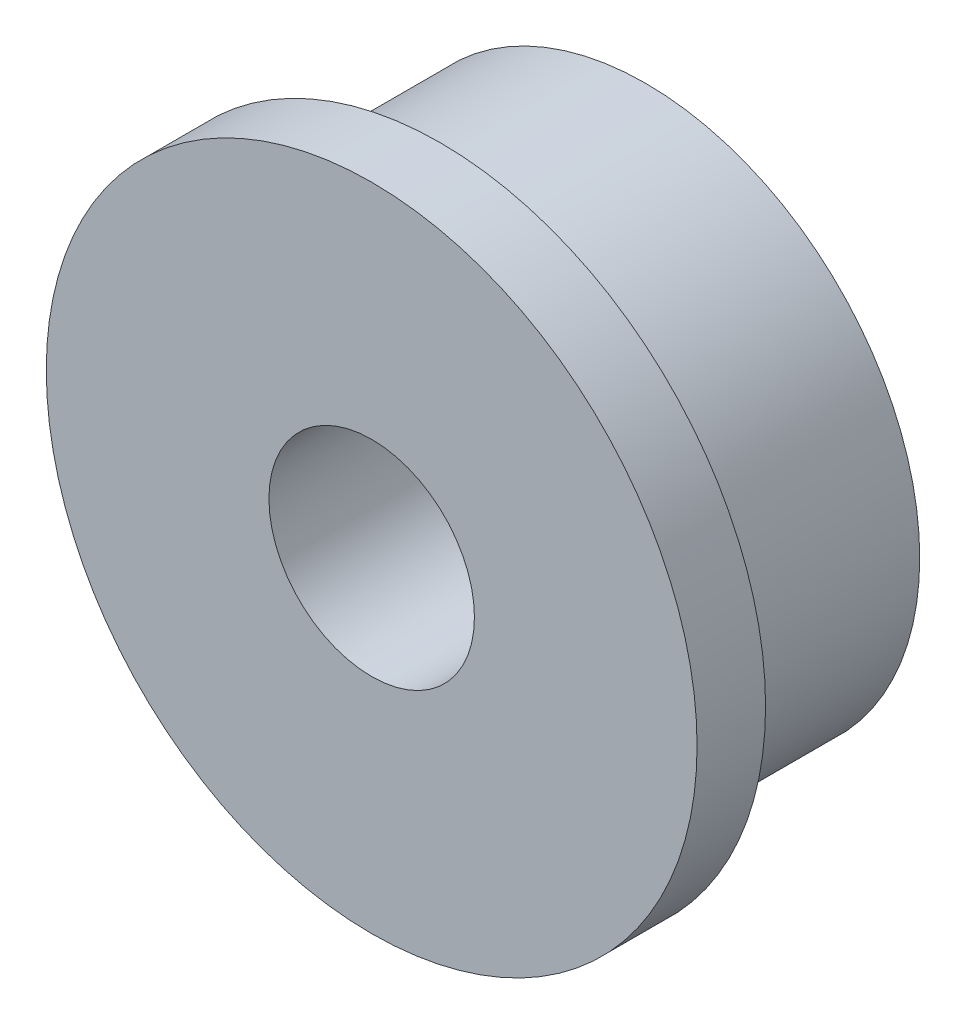
from build123d import *

# Parameters (mm, degrees)
SKETCH_1_R      = 4
SKETCH_1_R_2    = 1.5
EXTRUDE_1_DEPTH = 3
SKETCH_2_R      = 4.75
SKETCH_2_R_2    = 1.5
EXTRUDE_2_DEPTH = 1


with BuildPart() as part:
    # 草图1 → 凸台-拉伸1 (new body)
    with BuildSketch(Plane.XY):
        Circle(SKETCH_1_R)
        Circle(SKETCH_1_R_2, mode=Mode.SUBTRACT)
    extrude(amount=EXTRUDE_1_DEPTH)

    # 草图2 → 凸台-拉伸2 (add)
    with BuildSketch(Plane.XY.offset(3)):
        Circle(SKETCH_2_R)
        Circle(SKETCH_2_R_2, mode=Mode.SUBTRACT)
    extrude(amount=EXTRUDE_2_DEPTH)


solid = part.part
